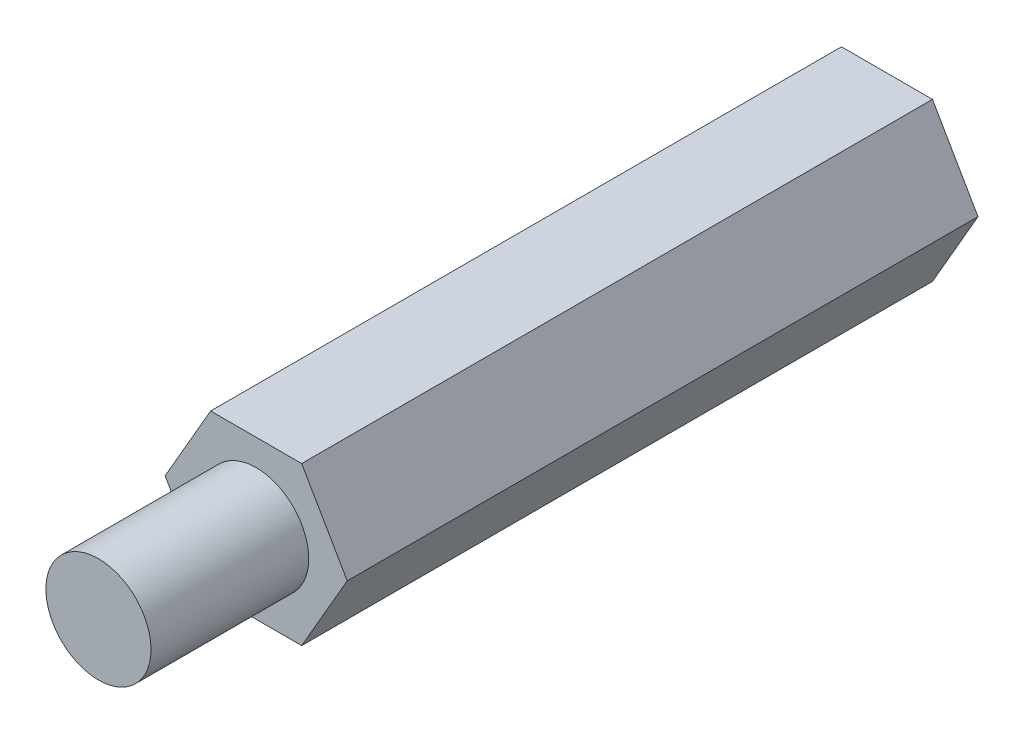
from build123d import *

# Parameters (mm, degrees)
EXTRUDE_1_DEPTH        = 12
SKETCH_2_R             = 1
EXTRUDE_2_DEPTH        = 3
HOLE_WIZARD_M2_1_D     = 2.4
HOLE_WIZARD_M2_1_DEPTH = 3
HOLE_WIZARD_M2_1_TIP   = 0.721032743


with BuildPart() as part:
    # 스케치1 → 보스-돌출1 (new body)
    with BuildSketch(Plane.XY):
        Polygon((0.866025404, -1.5), (1.732050808, 0), (0.866025404, 1.5), (-0.866025404, 1.5), (-1.732050808, 0), (-0.866025404, -1.5), align=None)
    extrude(amount=EXTRUDE_1_DEPTH)

    # 스케치2 → 보스-돌출2 (add)
    with BuildSketch(Plane.XY.offset(12)):
        Circle(SKETCH_2_R)
    extrude(amount=EXTRUDE_2_DEPTH)

    # M2 여유 구멍1
    with Locations(Plane(origin=(0, 0, 0), x_dir=(-1, 0, 0), z_dir=(0, 0, -1))):
        with Locations((0, 0)):
            Hole(HOLE_WIZARD_M2_1_D / 2, depth=HOLE_WIZARD_M2_1_DEPTH)
            with Locations((0, 0, -(HOLE_WIZARD_M2_1_DEPTH + HOLE_WIZARD_M2_1_TIP / 2))):  # 118° drill point
                Cone(0, HOLE_WIZARD_M2_1_D / 2, HOLE_WIZARD_M2_1_TIP, mode=Mode.SUBTRACT)


solid = part.part
